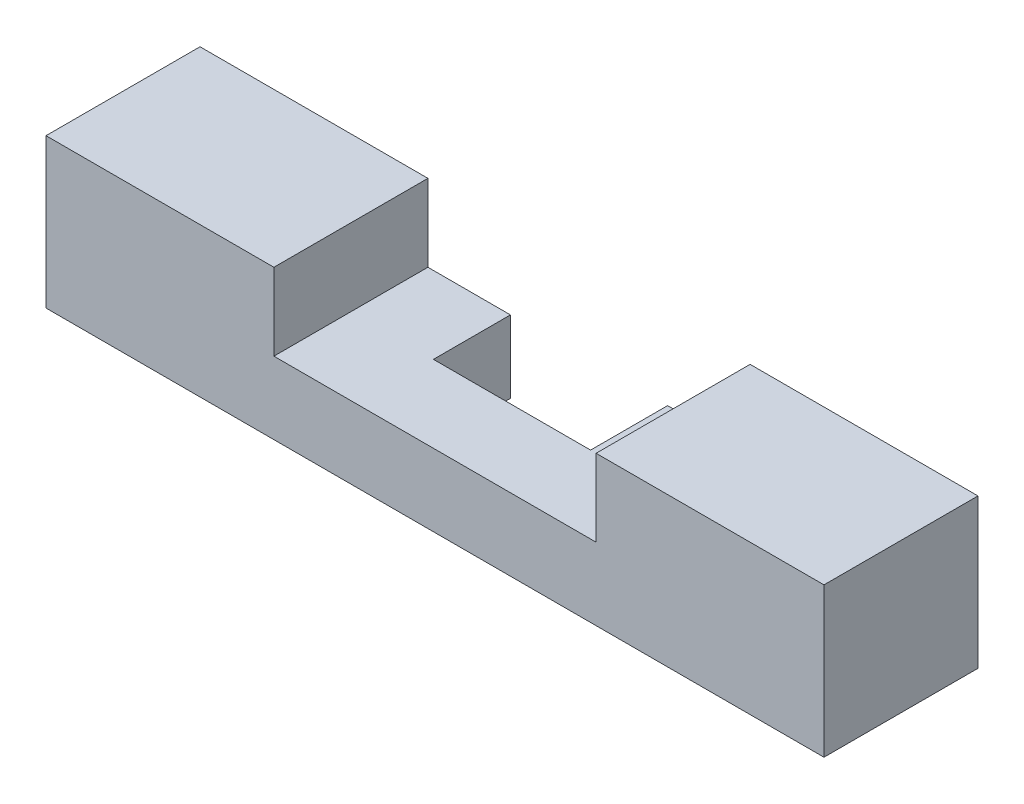
from build123d import *

# Parameters (mm, degrees)
SKETCH_1_W          = 99
SKETCH_1_H          = 19
EXTRUDE_1_DEPTH     = 19.6
SKETCH_3_W          = 41
SKETCH_3_H          = 19.6
CUT_EXTRUDE_1_DEPTH = 9.8
SKETCH_6_W          = 20
SKETCH_6_H          = 19.6
CUT_EXTRUDE_2_DEPTH = 15.5
SHELL_2_T           = -2
SKETCH_7_W          = 99
SKETCH_7_H          = 19.6
EXTRUDE_3_DEPTH     = 0.5
SKETCH_21_W         = 20
SKETCH_21_H         = 9.8
CUT_EXTRUDE_3_DEPTH = 6.5


with BuildPart() as part:
    # 草圖1 → 填料-伸長1 (new body)
    with BuildSketch(Plane.XY):
        Rectangle(SKETCH_1_W, SKETCH_1_H)
    extrude(amount=EXTRUDE_1_DEPTH)

    # 草圖3 → 除料-伸長1 (cut)
    with BuildSketch(Plane(origin=(0, 9.5, 0), x_dir=(1, 0, 0), z_dir=(0, 1, 0))):
        with Locations((0, -9.8)):
            Rectangle(SKETCH_3_W, SKETCH_3_H)
    extrude(amount=-CUT_EXTRUDE_1_DEPTH, mode=Mode.SUBTRACT)

    # 草圖6 → 除料-伸長2 (cut)
    with BuildSketch(Plane(origin=(0, -0.3, 0), x_dir=(1, 0, 0), z_dir=(0, 1, 0))):
        Rectangle(SKETCH_6_W, SKETCH_6_H)
    extrude(amount=-CUT_EXTRUDE_2_DEPTH, mode=Mode.SUBTRACT)

    # 薄殼2
    shell_2_openings = [part.faces().sort_by_distance(p)[0] for p in [
        (0, -9.5, 10.350561798),
    ]]
    offset(amount=SHELL_2_T, openings=shell_2_openings, kind=Kind.INTERSECTION)

    # 草圖7 → 填料-伸長3 (add)
    with BuildSketch(Plane.XZ.offset(9.5)):
        with Locations((0, 9.8)):
            Rectangle(SKETCH_7_W, SKETCH_7_H)
    extrude(amount=-EXTRUDE_3_DEPTH)

    # 草圖21 → 除料-伸長3 (cut)
    with BuildSketch(Plane(origin=(0, -9, 0), x_dir=(1, 0, 0), z_dir=(0, 1, 0))):
        with Locations((0, -4.9)):
            Rectangle(SKETCH_21_W, SKETCH_21_H)
    extrude(amount=-CUT_EXTRUDE_3_DEPTH, mode=Mode.SUBTRACT)


solid = part.part
